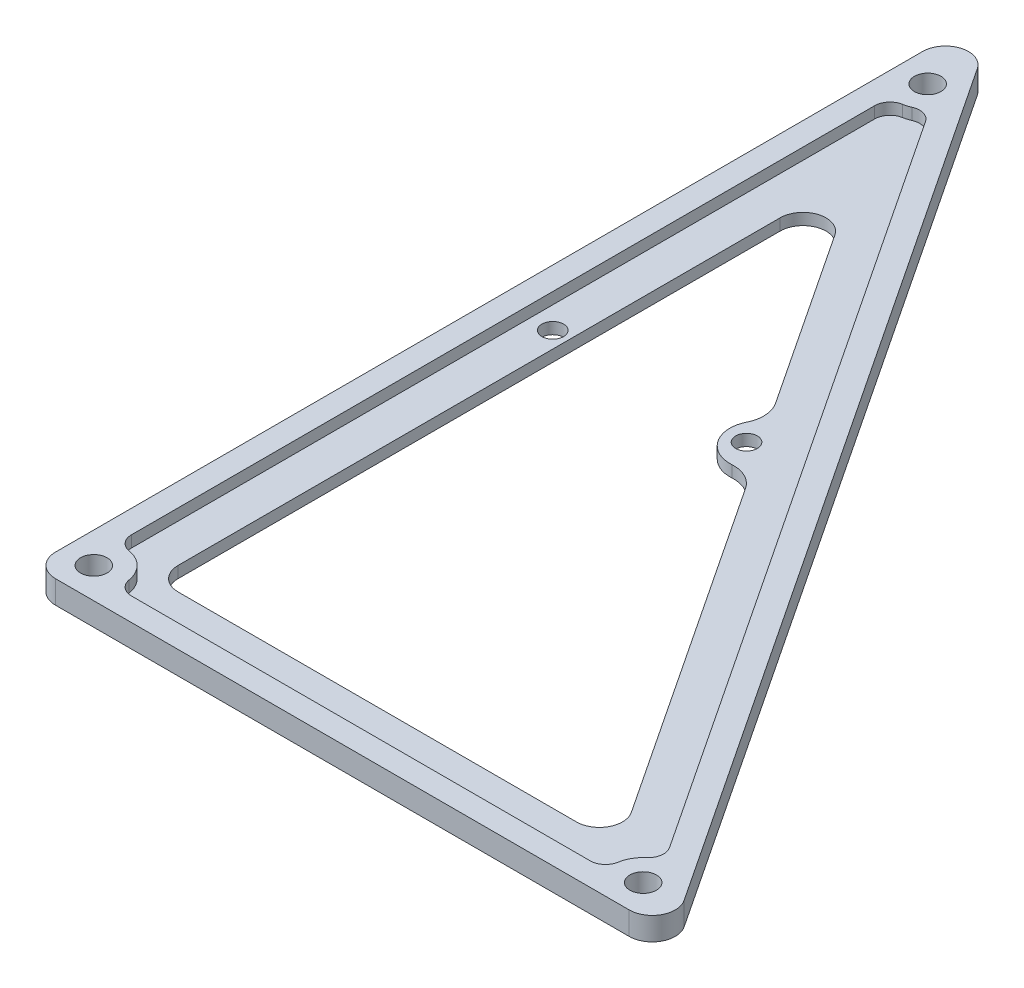
from build123d import *

# Parameters (mm, degrees)
BOSS_EXTRUDE1_DEPTH          = 4.7625
FILLET5_R                    = 4.7625
F_97_0_0059_DIAMETER_HOLE1_D = 5.499999922
CUT_EXTRUDE1_DEPTH           = 2.38125
F_8_CLEARANCE_HOLE1_D        = 4.4958


with BuildPart() as part:
    # Sketch1 → Boss-Extrude1 (new body)
    with BuildSketch(Plane(origin=(0, 0, 0), x_dir=(1, 0, 0), z_dir=(0, 1, 0))):
        Polygon((-6.35, 193.821953186), (126.116733726, -6.35), (-6.35, -6.35), align=None)
        with BuildLine():
            Line((51.297931724, 83.696727765), (102.483266274, 6.35))
            Line((102.483266274, 6.35), (6.35, 6.35))
            Line((6.35, 6.35), (6.35, 151.618046814))
            Line((6.35, 151.618046814), (39.158490531, 102.040772235))
            ThreePointArc((39.158490531, 102.040772235), (40.201209552, 98.92354296), (39.545616076, 95.702583707))
            ThreePointArc((39.545616076, 95.702583707), (39.932741621, 89.36439518), (45.615336672, 86.530561472))
            ThreePointArc((45.615336672, 86.530561472), (48.836295925, 85.874967996), (51.297931724, 83.696727765))
        make_face(mode=Mode.SUBTRACT)
    extrude(amount=BOSS_EXTRUDE1_DEPTH)

    # Fillet5
    fillet5_edges = [part.edges().sort_by_distance(p)[0] for p in [
        (6.35, 2.38125, -151.618046814),
        (6.35, 2.38125, -6.35),
        (102.483266274, 2.38125, -6.35),
        (-6.35, 2.38125, -193.821953186),
        (126.116733726, 2.38125, 6.35),
        (-6.35, 2.38125, 6.35),
    ]]
    fillet(fillet5_edges, radius=FILLET5_R)

    # #97 (0.0059) Diameter Hole1 (through all)
    with Locations(Plane(origin=(0, 4.7625, 0), x_dir=(1, 0, 0), z_dir=(0, 1, 0))):
        with Locations((0, 172.72), (0, 0), (113.792, 0)):
            Hole(F_97_0_0059_DIAMETER_HOLE1_D / 2)

    # Sketch5 → Cut-Extrude1 (cut)
    with BuildSketch(Plane(origin=(0, 4.7625, 0), x_dir=(1, 0, 0), z_dir=(0, 1, 0))):
        with BuildLine():
            Line((110.252008963, 8.993563641), (6.506878053, 165.763983683))
            ThreePointArc((6.506878053, 165.763983683), (4.750358466, 167.059159309), (2.5727622, 166.914537515))
            ThreePointArc((2.5727622, 166.914537515), (1.829790785, 166.639344963), (1.058333333, 166.458815563))
            ThreePointArc((1.058333333, 166.458815563), (-0.837446305, 165.377677032), (-1.5875, 163.328223344))
            Line((-1.5875, 163.328223344), (-1.5875, 9.391776656))
            ThreePointArc((-1.5875, 9.391776656), (-0.837446305, 7.342322968), (1.058333333, 6.261184437))
            ThreePointArc((1.058333333, 6.261184437), (4.490128061, 4.490128061), (6.261184437, 1.058333333))
            ThreePointArc((6.261184437, 1.058333333), (7.342322968, -0.837446305), (9.391776656, -1.5875))
            Line((9.391776656, -1.5875), (104.400223344, -1.5875))
            ThreePointArc((104.400223344, -1.5875), (106.449677032, -0.837446305), (107.530815563, 1.058333333))
            ThreePointArc((107.530815563, 1.058333333), (108.267435402, 3.130764444), (109.666849473, 4.827590821))
            ThreePointArc((109.666849473, 4.827590821), (110.748409623, 6.799755727), (110.252008963, 8.993563641))
        make_face()
    extrude(amount=-CUT_EXTRUDE1_DEPTH, mode=Mode.SUBTRACT)

    # #8 Clearance Hole1 (through all)
    with Locations(Plane(origin=(0, 2.38125, 0), x_dir=(1, 0, 0), z_dir=(0, 1, 0))):
        with Locations((2.9845, 92.075), (43.1165, 92.075)):
            Hole(F_8_CLEARANCE_HOLE1_D / 2)


solid = part.part
